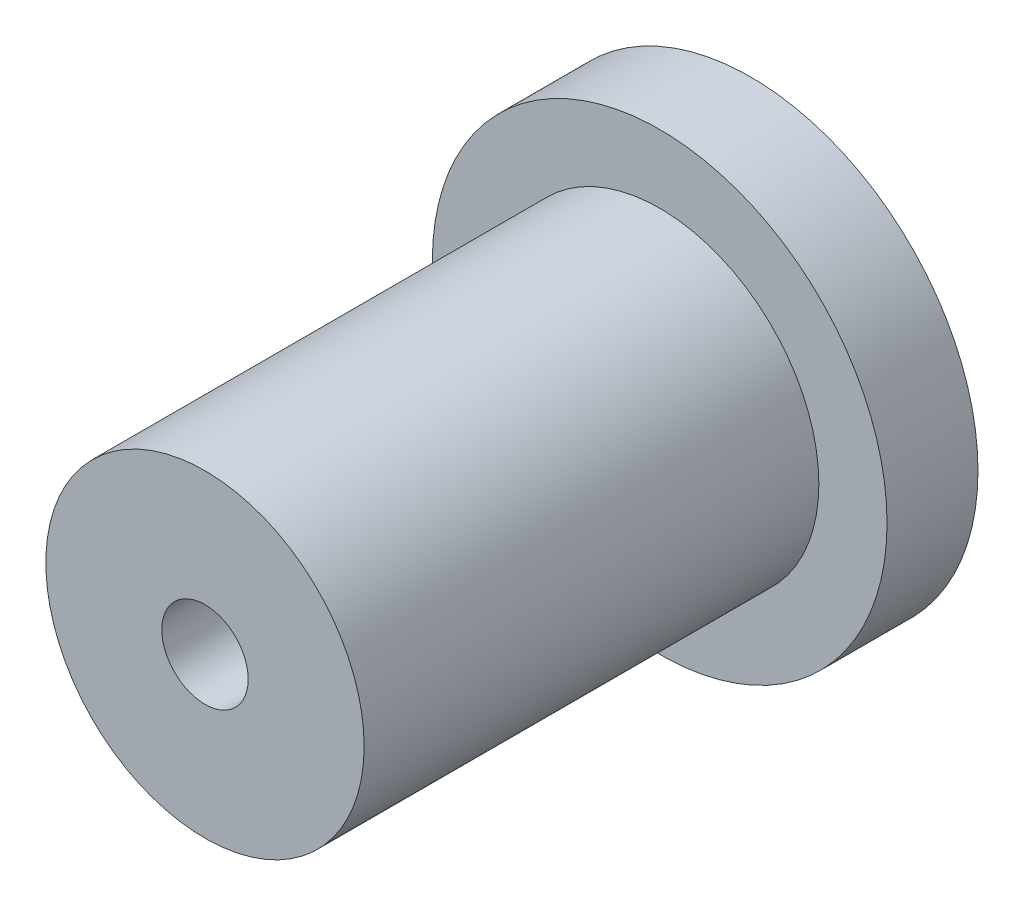
from build123d import *

# Parameters (mm, degrees)
SKETCH2_R           = 5
BOSS_EXTRUDE1_DEPTH = 2
SKETCH3_R           = 3.5
BOSS_EXTRUDE2_DEPTH = 10
SKETCH4_R           = 0.95
CUT_EXTRUDE1_DEPTH  = 14.928388277


with BuildPart() as part:
    # Sketch2 → Boss-Extrude1 (new body)
    with BuildSketch(Plane.XY):
        Circle(SKETCH2_R)
    extrude(amount=BOSS_EXTRUDE1_DEPTH)

    # Sketch3 → Boss-Extrude2 (add)
    with BuildSketch(Plane.XY.offset(2)):
        Circle(SKETCH3_R)
    extrude(amount=BOSS_EXTRUDE2_DEPTH)

    # Sketch4 → Cut-Extrude1 (cut, through all)
    with BuildSketch(Plane.XY.offset(12)):
        Circle(SKETCH4_R)
    extrude(amount=-CUT_EXTRUDE1_DEPTH, mode=Mode.SUBTRACT)


solid = part.part
